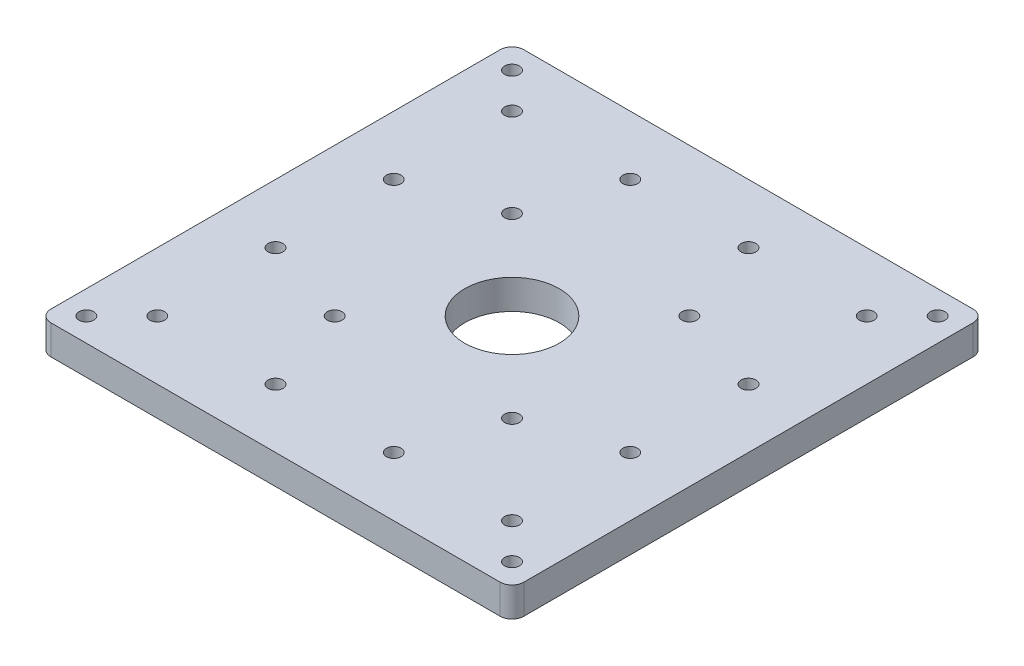
from build123d import *

# Parameters (mm, degrees)
ESQUISSE1_W                     = 80
ESQUISSE1_H                     = 80
ESQUISSE1_R                     = 1.25
ESQUISSE1_R_2                   = 8
EXTRUSION1_DEPTH                = 5
ESQUISSE2_R                     = 1.25
ENL_V_MAT_EXTRU_1_DEPTH         = 57.789083458
R_P_TITION_LIN_AIRE1_COUNT      = 4
R_P_TITION_LIN_AIRE1_PITCH      = 20
R_P_TITION_LIN_AIRE1_COUNT_DIR2 = 4
R_P_TITION_LIN_AIRE1_PITCH_DIR2 = 20
CONG_1_R                        = 2


with BuildPart() as part:
    # Esquisse1 → Extrusion1 (new body)
    with BuildSketch(Plane(origin=(0, 0, 0), x_dir=(1, 0, 0), z_dir=(0, 1, 0))):
        Rectangle(ESQUISSE1_W, ESQUISSE1_H)
        with Locations(Location((-15, 15, 0), (0, 0, 270))):
            Circle(ESQUISSE1_R, mode=Mode.SUBTRACT)
        with Locations(Location((15, 15, 0), (0, 0, 90))):
            Circle(ESQUISSE1_R, mode=Mode.SUBTRACT)
        with Locations(Location((-15, -15, 0), (0, 0, 90))):
            Circle(ESQUISSE1_R, mode=Mode.SUBTRACT)
        with Locations(Location((15, -15, 0), (0, 0, 270))):
            Circle(ESQUISSE1_R, mode=Mode.SUBTRACT)
        with Locations(Location((-36, 36, 0), (0, 0, 270))):
            Circle(ESQUISSE1_R, mode=Mode.SUBTRACT)
        with Locations(Location((36, 36, 0), (0, 0, 90))):
            Circle(ESQUISSE1_R, mode=Mode.SUBTRACT)
        with Locations(Location((36, -36, 0), (0, 0, 270))):
            Circle(ESQUISSE1_R, mode=Mode.SUBTRACT)
        with Locations(Location((-36, -36, 0), (0, 0, 90))):
            Circle(ESQUISSE1_R, mode=Mode.SUBTRACT)
        with Locations(Location((0, 0, 0), (0, 0, 270))):
            Circle(ESQUISSE1_R_2, mode=Mode.SUBTRACT)
    extrude(amount=EXTRUSION1_DEPTH)

    # Esquisse2 → Enlèv. mat.-Extru.1 (cut, through all)
    with BuildSketch(Plane(origin=(0, 5, 0), x_dir=(1, 0, 0), z_dir=(0, 1, 0))):
        with Locations(Location((-30, 30, 0), (0, 0, 270))):
            Circle(ESQUISSE2_R)
    enl_v_mat_extru_1 = extrude(amount=-ENL_V_MAT_EXTRU_1_DEPTH, mode=Mode.SUBTRACT)

    # Répétition linéaire1: Enl_v. mat.-Extru.1 4 × 4, 4 skipped
    with Locations(*[(j * R_P_TITION_LIN_AIRE1_PITCH_DIR2, 0, i * R_P_TITION_LIN_AIRE1_PITCH) for i in range(R_P_TITION_LIN_AIRE1_COUNT) for j in range(R_P_TITION_LIN_AIRE1_COUNT_DIR2) if (i, j) not in ((0, 0), (1, 1), (1, 2), (2, 1), (2, 2))]):
        add(enl_v_mat_extru_1, mode=Mode.SUBTRACT)

    # Congé1
    cong_1_edges = [part.edges().sort_by_distance(p)[0] for p in [
        (-40, 2.5, -40),
        (40, 2.5, -40),
        (40, 2.5, 40),
        (-40, 2.5, 40),
    ]]
    fillet(cong_1_edges, radius=CONG_1_R)


solid = part.part
